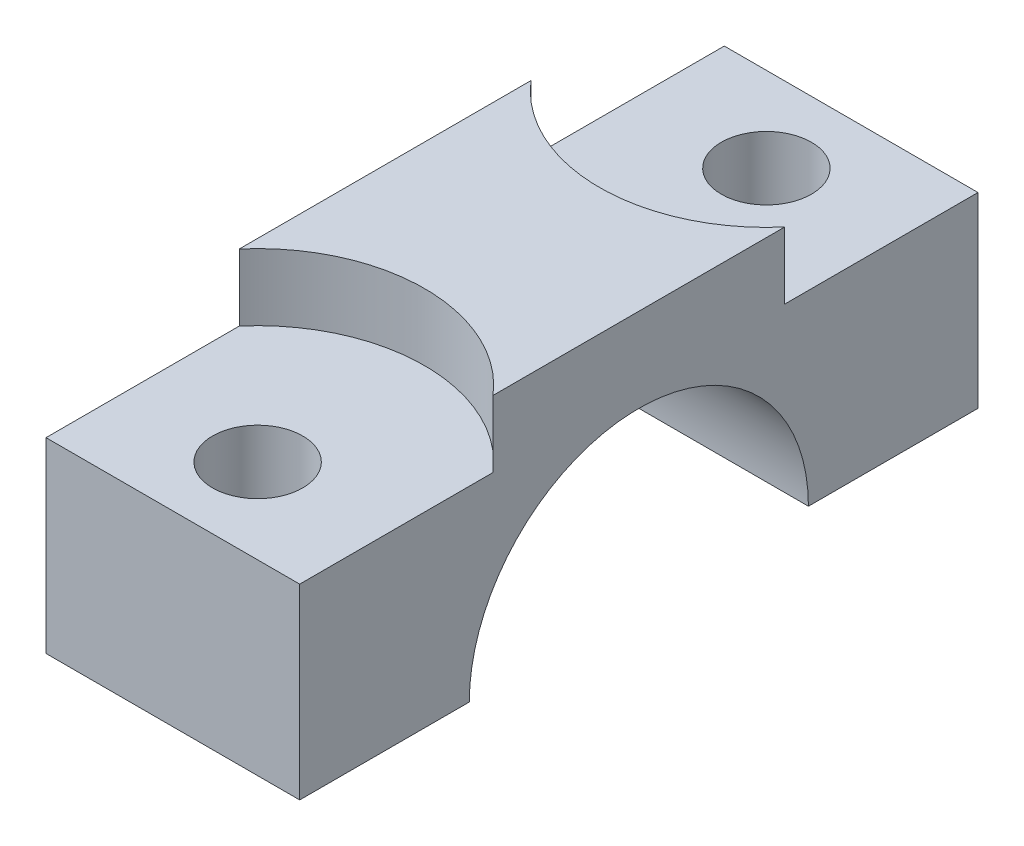
from build123d import *

# Parameters (mm, degrees)
BOSS_EXTRUDE1_DEPTH                           = 9.5
CBORE_FOR_M12_HEX_HEAD_CAP_SCREW2_D           = 6.75
CBORE_FOR_M12_HEX_HEAD_CAP_SCREW2_CBORE_D     = 25
CBORE_FOR_M12_HEX_HEAD_CAP_SCREW2_CBORE_DEPTH = 5


with BuildPart() as part:
    # Sketch1 → Boss-Extrude1 (new, symmetric)
    with BuildSketch(Plane(origin=(0, 0, 0), x_dir=(0, 0, -1), z_dir=(1, 0, 0))):
        with BuildLine():
            Line((25.4, 19), (-25.4, 19))
            Line((-25.4, 19), (-25.4, 0))
            Line((-25.4, 0), (-12.7, 0))
            ThreePointArc((-12.7, 0), (0, 12.7), (12.7, 0))
            Line((12.7, 0), (25.4, 0))
            Line((25.4, 0), (25.4, 19))
        make_face()
    extrude(amount=BOSS_EXTRUDE1_DEPTH, both=True)

    # CBORE for M12 Hex Head Cap Screw2 (through all)
    with Locations(Plane(origin=(0, 19, -19.05), x_dir=(0, 0, 1), z_dir=(0, 1, 0))):
        with Locations((0, 0), (38.1, 0)):
            CounterBoreHole(CBORE_FOR_M12_HEX_HEAD_CAP_SCREW2_D / 2, CBORE_FOR_M12_HEX_HEAD_CAP_SCREW2_CBORE_D / 2, CBORE_FOR_M12_HEX_HEAD_CAP_SCREW2_CBORE_DEPTH)


solid = part.part
